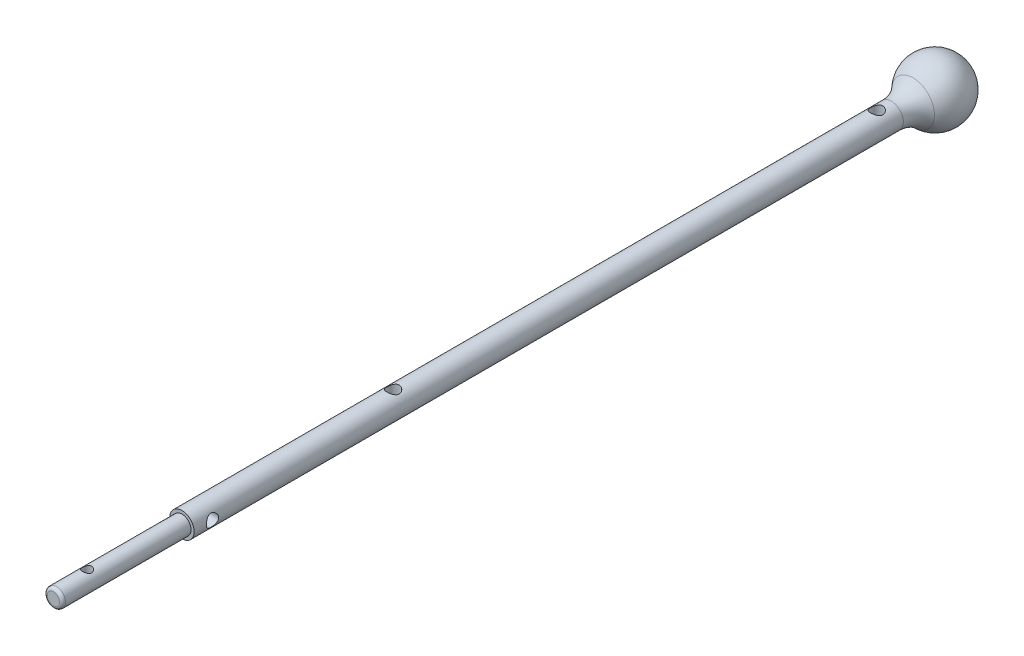
from build123d import *

# Parameters (mm, degrees)
SKETCH1_R               = 1.5
BOSS_EXTRUDE1_DEPTH     = 21
SKETCH2_R               = 2
BOSS_EXTRUDE2_DEPTH     = 123
FILLET1_R               = 5
FILLET2_R               = 0.5
CUT_EXTRUDE1_DEPTH      = 129.195163715
CUT_EXTRUDE1_DEPTH_BACK = 129.195163715
SKETCH4_R               = 0.75
SKETCH4_R_2             = 1
CUT_EXTRUDE2_DEPTH      = 129.195163715
CUT_EXTRUDE2_DEPTH_BACK = 129.195163715
SKETCH5_R               = 1


with BuildPart() as part:
    # Sketch1 → Boss-Extrude1 (new body)
    with BuildSketch(Plane.XY):
        with Locations(Location((0, 0, 0), (0, 0, 180))):
            Circle(SKETCH1_R)
    extrude(amount=BOSS_EXTRUDE1_DEPTH)

    # Sketch2 → Boss-Extrude2 (add)
    with BuildSketch(Plane(origin=(0, 0, 0), x_dir=(-1, 0, 0), z_dir=(0, 0, -1))):
        Circle(SKETCH2_R)
    extrude(amount=BOSS_EXTRUDE2_DEPTH)

    # Sketch3 → Revolve1 (revolve)
    with BuildSketch(Plane(origin=(0, 0, 0), x_dir=(1, 0, 0), z_dir=(0, 1, 0))):
        with BuildLine():
            Line((-5, 123), (5, 123))
            ThreePointArc((5, 123), (0, 128), (-5, 123))
        make_face()
    revolve(axis=Axis((-5, 0, -123), (1, 0, 0)))

    # Fillet1
    fillet1_edges = [part.edges().sort_by_distance(p)[0] for p in [
        (2, 0, -118.417424305),
    ]]
    fillet(fillet1_edges, radius=FILLET1_R)

    # Fillet2
    fillet2_edges = [part.edges().sort_by_distance(p)[0] for p in [
        (1.5, 0, 21),
    ]]
    fillet(fillet2_edges, radius=FILLET2_R)

    # Sketch4 → Cut-Extrude1 (cut, two sides: drawn at the far end of the back side and taken through both)
    with BuildSketch(Plane(origin=(0, 0, 0), x_dir=(1, 0, 0), z_dir=(0, 1, 0)).offset(-CUT_EXTRUDE1_DEPTH_BACK)):
        with Locations(Location((0, -15.5, 0), (0, 0, 270))):
            Circle(SKETCH4_R)
        with Locations(Location((0, 34.5, 0), (0, 0, 270))):
            Circle(SKETCH4_R_2)
        with Locations(Location((0, 113.5, 0), (0, 0, 270))):
            Circle(SKETCH4_R_2)
    extrude(amount=CUT_EXTRUDE1_DEPTH + CUT_EXTRUDE1_DEPTH_BACK, mode=Mode.SUBTRACT)

    # Sketch5 → Cut-Extrude2 (cut, two sides: drawn at the far end of the back side and taken through both)
    with BuildSketch(Plane(origin=(0, 0, 0), x_dir=(0, 0, -1), z_dir=(1, 0, 0)).offset(-CUT_EXTRUDE2_DEPTH_BACK)):
        with Locations((3, 0)):
            Circle(SKETCH5_R)
    extrude(amount=CUT_EXTRUDE2_DEPTH + CUT_EXTRUDE2_DEPTH_BACK, mode=Mode.SUBTRACT)


solid = part.part
